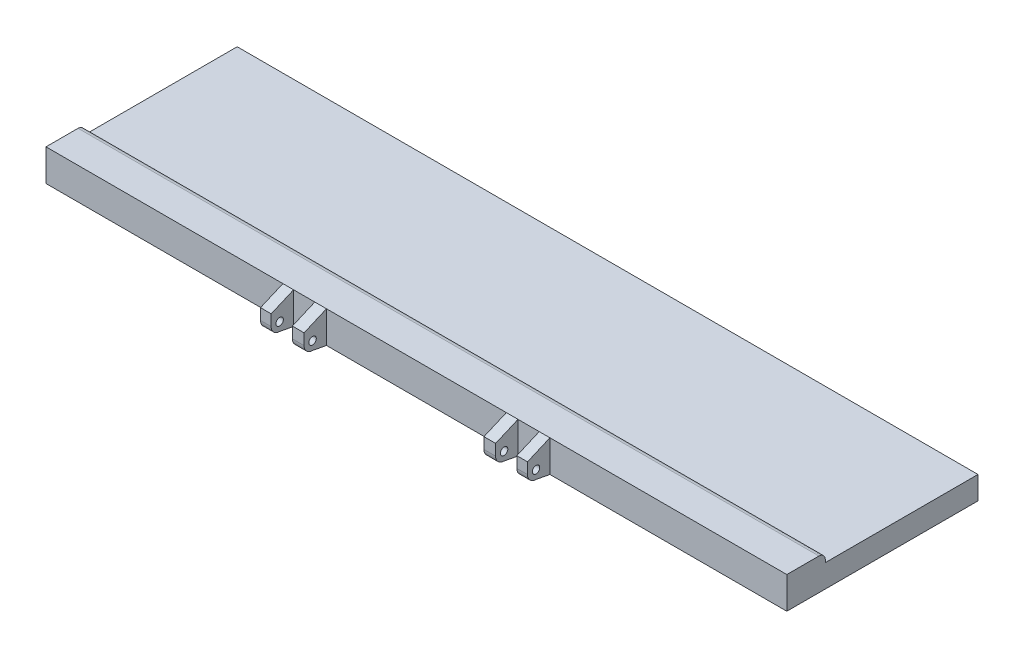
from build123d import *

# Parameters (mm, degrees)
SKETCH1_W           = 8.39079
SKETCH1_H           = 17.612704871
SKETCH1_W_2         = 9.17363
BOSS_EXTRUDE1_DEPTH = 25
SKETCH2_R           = 2.9110285
CUT_EXTRUDE1_DEPTH  = 409.009554619
CUT_EXTRUDE2_DEPTH  = 409.009554619
SKETCH4_W           = 582.34
SKETCH4_H           = 123.66999206
CUT_EXTRUDE3_DEPTH  = 7
FILLET1_R           = 5
SKETCH5_W           = 582.34
SKETCH5_H           = 3.612357777
CUT_EXTRUDE4_DEPTH  = 307.667781892


with BuildPart() as part:
    # Sketch1 → Boss-Extrude1 (new body)
    with BuildSketch(Plane(origin=(0, 0, 0), x_dir=(1, 0, 0), z_dir=(0, 1, 0))):
        Polygon((291.17, 76.945), (-291.17, 76.945), (-291.17, -76.945), (-104.943162, -76.945), (-96.552372, -76.945), (-79.86659, -76.945), (-70.69296, -76.945), (70.69296, -76.945), (79.86659, -76.945), (96.552372, -76.945), (104.943162, -76.945), (291.17, -76.945), align=None)
        with Locations((100.747767, -85.751352436)):
            Rectangle(SKETCH1_W, SKETCH1_H)
        with Locations((75.279775, -85.751352436)):
            Rectangle(SKETCH1_W_2, SKETCH1_H)
        with Locations((-75.279775, -85.751352436)):
            Rectangle(SKETCH1_W_2, SKETCH1_H)
        with Locations((-100.747767, -85.751352436)):
            Rectangle(SKETCH1_W, SKETCH1_H)
    extrude(amount=BOSS_EXTRUDE1_DEPTH)

    # Sketch2 → Cut-Extrude1 (cut, through all)
    with BuildSketch(Plane(origin=(104.943162, 0, 0), x_dir=(0, 0, -1), z_dir=(1, 0, 0))):
        with Locations((-87.882438934, 8.748719463)):
            Circle(SKETCH2_R)
    extrude(amount=-CUT_EXTRUDE1_DEPTH, mode=Mode.SUBTRACT)

    # Sketch3 → Cut-Extrude2 (cut, through all)
    with BuildSketch(Plane(origin=(104.943162, 0, 0), x_dir=(0, 0, -1), z_dir=(1, 0, 0))):
        with BuildLine():
            Line((-76.945, 0), (-87.882438934, 2.073453526))
            ThreePointArc((-87.882438934, 2.073453526), (-92.59600701, 4.012761881), (-94.557704871, 8.717055919))
            Line((-94.557704871, 8.717055919), (-94.557704871, 0))
            Line((-94.557704871, 0), (-76.945, 0))
        make_face()
        Polygon((-94.557704871, 17.434111839), (-76.945, 25), (-94.557704871, 25), align=None)
    extrude(amount=-CUT_EXTRUDE2_DEPTH, mode=Mode.SUBTRACT)

    # Sketch4 → Cut-Extrude3 (cut)
    with BuildSketch(Plane(origin=(0, 25, 0), x_dir=(1, 0, 0), z_dir=(0, 1, 0))):
        with Locations((0, 15.117928008)):
            Rectangle(SKETCH4_W, SKETCH4_H)
    extrude(amount=-CUT_EXTRUDE3_DEPTH, mode=Mode.SUBTRACT)

    # Fillet1
    fillet1_edges = [part.edges().sort_by_distance(p)[0] for p in [
        (0, 25, 46.717068022),
    ]]
    fillet(fillet1_edges, radius=FILLET1_R)

    # Sketch5 → Cut-Extrude4 (cut, through all)
    with BuildSketch(Plane(origin=(0, 18, 0), x_dir=(1, 0, 0), z_dir=(0, 1, 0))):
        with Locations((0, 75.138821112)):
            Rectangle(SKETCH5_W, SKETCH5_H)
    extrude(amount=-CUT_EXTRUDE4_DEPTH, mode=Mode.SUBTRACT)


solid = part.part
